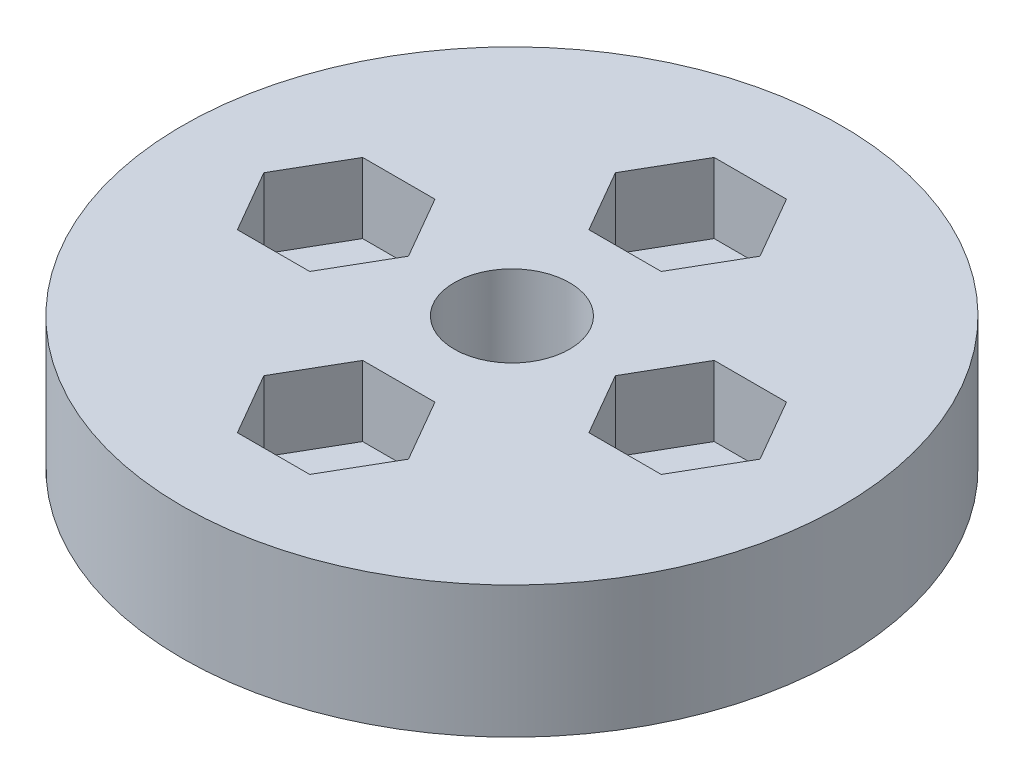
from build123d import *

# Parameters (mm, degrees)
SKETCH1_R           = 15
SKETCH1_R_2         = 1.5
SKETCH1_R_3         = 2.625
BOSS_EXTRUDE1_DEPTH = 6
CUT_EXTRUDE1_DEPTH  = 3.2


with BuildPart() as part:
    # Sketch1 → Boss-Extrude1 (new body)
    with BuildSketch(Plane(origin=(0, 0, 0), x_dir=(1, 0, 0), z_dir=(0, 1, 0))):
        with Locations(Location((0, 0, 0), (0, 0, 270))):
            Circle(SKETCH1_R)
        with Locations(Location((0, 8, 0), (0, 0, 270))):
            Circle(SKETCH1_R_2, mode=Mode.SUBTRACT)
        with Locations(Location((8, 0, 0), (0, 0, 270))):
            Circle(SKETCH1_R_2, mode=Mode.SUBTRACT)
        with Locations(Location((0, -8, 0), (0, 0, 270))):
            Circle(SKETCH1_R_2, mode=Mode.SUBTRACT)
        with Locations(Location((-8, 0, 0), (0, 0, 270))):
            Circle(SKETCH1_R_2, mode=Mode.SUBTRACT)
        with Locations(Location((0, 0, 0), (0, 0, 270))):
            Circle(SKETCH1_R_3, mode=Mode.SUBTRACT)
    extrude(amount=BOSS_EXTRUDE1_DEPTH)

    # Sketch2 → Cut-Extrude1 (cut)
    with BuildSketch(Plane(origin=(0, 6, 0), x_dir=(1, 0, 0), z_dir=(0, 1, 0))):
        Polygon((3.290896534, 8), (1.645448267, 10.85), (-1.645448267, 10.85), (-3.290896534, 8), (-1.645448267, 5.15), (1.645448267, 5.15), align=None)
        Polygon((11.290896534, 0), (9.645448267, 2.85), (6.354551733, 2.85), (4.709103466, 0), (6.354551733, -2.85), (9.645448267, -2.85), align=None)
        Polygon((-4.709103466, 0), (-6.354551733, 2.85), (-9.645448267, 2.85), (-11.290896534, 0), (-9.645448267, -2.85), (-6.354551733, -2.85), align=None)
        Polygon((3.290896534, -8), (1.645448267, -5.15), (-1.645448267, -5.15), (-3.290896534, -8), (-1.645448267, -10.85), (1.645448267, -10.85), align=None)
    extrude(amount=-CUT_EXTRUDE1_DEPTH, mode=Mode.SUBTRACT)


solid = part.part
